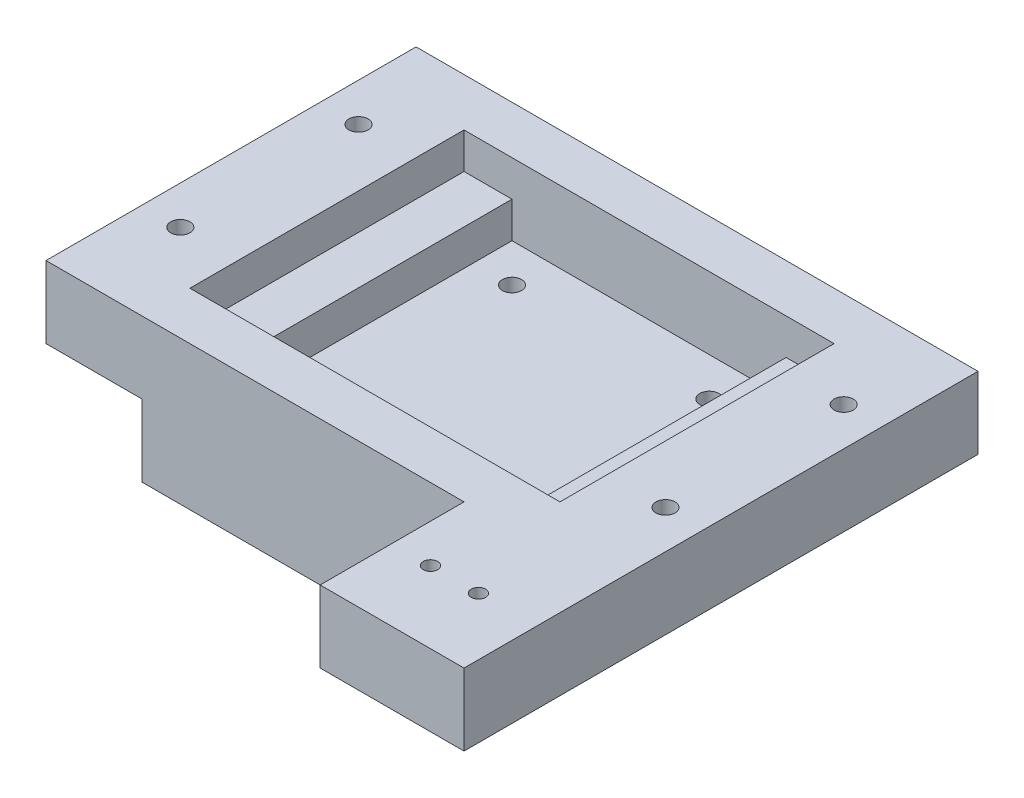
from build123d import *

# Parameters (mm, degrees)
CROQUIS1_W              = 77.15
CROQUIS1_H              = 77.15
SALIENTE_EXTRUIR1_DEPTH = 15
CROQUIS4_W              = 10
CROQUIS4_H              = 77.15
SALIENTE_EXTRUIR2_DEPTH = 7.5
CROQUIS4_3_W            = 20
CROQUIS4_3_H            = 77.15
SALIENTE_EXTRUIR3_DEPTH = 15
SALIENTE_EXTRUIR4_DEPTH = 10
CROQUIS7_R              = 2
CORTAR_EXTRUIR2_DEPTH   = 50
CROQUIS8_R              = 2
CORTAR_EXTRUIR3_DEPTH   = 40
CROQUIS9_W              = 117.15
CROQUIS9_H              = 15
SALIENTE_EXTRUIR5_DEPTH = 30
CROQUIS10_W             = 87.15
CROQUIS10_H             = 30
CORTAR_EXTRUIR4_DEPTH   = 40
CROQUIS11_R             = 1.5
CORTAR_EXTRUIR5_DEPTH   = 10
CROQUIS12_R             = 1.25
CORTAR_EXTRUIR6_DEPTH   = 4.3


with BuildPart() as part:
    # Croquis1 → Saliente-Extruir1 (new body)
    with BuildSketch(Plane(origin=(0, 0, 0), x_dir=(1, 0, 0), z_dir=(0, 1, 0))):
        Rectangle(CROQUIS1_W, CROQUIS1_H)
    extrude(amount=SALIENTE_EXTRUIR1_DEPTH)

    # Croquis4 → Saliente-Extruir2 (add)
    with BuildSketch(Plane(origin=(0, 15, 0), x_dir=(1, 0, 0), z_dir=(0, 1, 0))):
        with Locations((-33.575, 0)):
            Rectangle(CROQUIS4_W, CROQUIS4_H)
    saliente_extruir2 = extrude(amount=SALIENTE_EXTRUIR2_DEPTH)

    # Croquis4<3> → Saliente-Extruir3 (add)
    with BuildSketch(Plane(origin=(0, 15, 0), x_dir=(1, 0, 0), z_dir=(0, 1, 0))):
        with Locations((-48.575, 0)):
            Rectangle(CROQUIS4_3_W, CROQUIS4_3_H)
    saliente_extruir3 = extrude(amount=SALIENTE_EXTRUIR3_DEPTH)

    # Simetría1: Saliente-Extruir2, Saliente-Extruir3 across plane
    add(saliente_extruir2.mirror(Plane.ZY))
    add(saliente_extruir3.mirror(Plane.ZY))

    # Croquis5 → Saliente-Extruir4 (add)
    with BuildSketch(Plane.XY.offset(38.575)):
        Polygon((-58.575, 30), (-38.575, 30), (38.575, 30), (58.575, 30), (58.575, 15), (38.575, 15), (38.575, 0), (-38.575, 0), (-38.575, 15), (-58.575, 15), align=None)
    saliente_extruir4 = extrude(amount=-SALIENTE_EXTRUIR4_DEPTH)

    # Croquis7 → Cortar-Extruir2 (cut)
    with BuildSketch(Plane(origin=(0, 15, 0), x_dir=(1, 0, 0), z_dir=(0, 1, 0))):
        with Locations((20.575, 20.575)):
            Circle(CROQUIS7_R)
        with Locations((-20.575, 20.575)):
            Circle(CROQUIS7_R)
        with Locations((20.575, -20.575)):
            Circle(CROQUIS7_R)
        with Locations((-20.575, -20.575)):
            Circle(CROQUIS7_R)
    extrude(amount=-CORTAR_EXTRUIR2_DEPTH, mode=Mode.SUBTRACT)

    # Croquis8 → Cortar-Extruir3 (cut)
    with BuildSketch(Plane(origin=(0, 30, 0), x_dir=(1, 0, 0), z_dir=(0, 1, 0))):
        with Locations((50.575, 18.575)):
            Circle(CROQUIS8_R)
        with Locations((50.575, -18.575)):
            Circle(CROQUIS8_R)
        with Locations((-50.575, 18.575)):
            Circle(CROQUIS8_R)
        with Locations((-50.575, -18.575)):
            Circle(CROQUIS8_R)
    extrude(amount=-CORTAR_EXTRUIR3_DEPTH, mode=Mode.SUBTRACT)

    # Simetría2: Saliente-Extruir4 across plane
    add(saliente_extruir4.mirror(Plane(origin=(0, 0, 0), x_dir=(1, 0, 0), z_dir=(0, 0, -1))))

    # Croquis9 → Saliente-Extruir5 (add)
    with BuildSketch(Plane.XY.offset(38.575)):
        with Locations((0, 22.5)):
            Rectangle(CROQUIS9_W, CROQUIS9_H)
    extrude(amount=SALIENTE_EXTRUIR5_DEPTH)

    # Croquis10 → Cortar-Extruir4 (cut)
    with BuildSketch(Plane(origin=(0, 30, 0), x_dir=(1, 0, 0), z_dir=(0, 1, 0))):
        with Locations((-15, -53.575)):
            Rectangle(CROQUIS10_W, CROQUIS10_H)
    extrude(amount=-CORTAR_EXTRUIR4_DEPTH, mode=Mode.SUBTRACT)

    # Croquis11 → Cortar-Extruir5 (cut)
    with BuildSketch(Plane(origin=(0, 30, 0), x_dir=(1, 0, 0), z_dir=(0, 1, 0))):
        with Locations((36.575, -53.575)):
            Circle(CROQUIS11_R)
        with Locations((46.575, -53.575)):
            Circle(CROQUIS11_R)
    extrude(amount=-CORTAR_EXTRUIR5_DEPTH, mode=Mode.SUBTRACT)

    # Croquis12 → Cortar-Extruir6 (cut)
    with BuildSketch(Plane(origin=(0, 0, -38.575), x_dir=(-1, 0, 0), z_dir=(0, 0, -1))):
        with Locations((0, 20)):
            Circle(CROQUIS12_R)
    extrude(amount=-CORTAR_EXTRUIR6_DEPTH, mode=Mode.SUBTRACT)


solid = part.part
